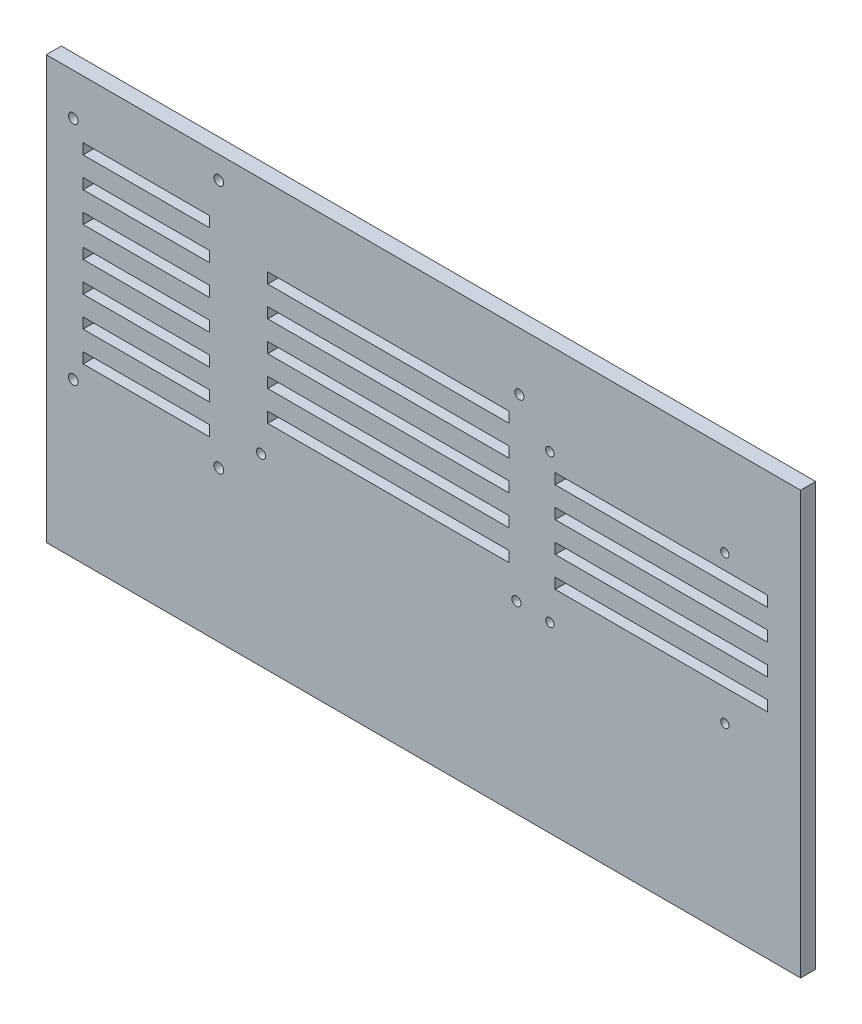
from build123d import *

# Parameters (mm, degrees)
CROQUIS1_W              = 250
CROQUIS1_H              = 140
CROQUIS1_R              = 1.6
CROQUIS1_R_2            = 1.375
CROQUIS1_R_3            = 1.5
CROQUIS1_W_2            = 41.859919993
CROQUIS1_H_2            = 3.5
CROQUIS1_W_3            = 79.963180499
CROQUIS1_W_4            = 70.346682928
SALIENTE_EXTRUIR1_DEPTH = 5


with BuildPart() as part:
    # Croquis1 → Saliente-Extruir1 (new body)
    with BuildSketch(Plane.XY):
        with Locations((14.354712009, 16.335108086)):
            Rectangle(CROQUIS1_W, CROQUIS1_H)
        with Locations((-101.706636686, -2.394891914)):
            Circle(CROQUIS1_R, mode=Mode.SUBTRACT)
        with Locations((-53.446636686, -3.664891914)):
            Circle(CROQUIS1_R, mode=Mode.SUBTRACT)
        with Locations((114.247224856, 6.848582104)):
            Circle(CROQUIS1_R_2, mode=Mode.SUBTRACT)
        with Locations((114.247224856, 55.848582104)):
            Circle(CROQUIS1_R_2, mode=Mode.SUBTRACT)
        with Locations((56.247224856, 6.848582104)):
            Circle(CROQUIS1_R_2, mode=Mode.SUBTRACT)
        with Locations((56.247224856, 55.848582104)):
            Circle(CROQUIS1_R_2, mode=Mode.SUBTRACT)
        with Locations((46.159209602, 67.214416737)):
            Circle(CROQUIS1_R_3, mode=Mode.SUBTRACT)
        with Locations((45.159209602, 7.414416737)):
            Circle(CROQUIS1_R_3, mode=Mode.SUBTRACT)
        with Locations((-39.460790398, 7.414416737)):
            Circle(CROQUIS1_R_3, mode=Mode.SUBTRACT)
        with Locations((-101.706636686, 72.535108086)):
            Circle(CROQUIS1_R, mode=Mode.SUBTRACT)
        with Locations((-53.446636686, 78.885108086)):
            Circle(CROQUIS1_R, mode=Mode.SUBTRACT)
        with Locations((-77.501473664, 55.441697687)):
            Rectangle(CROQUIS1_W_2, CROQUIS1_H_2, mode=Mode.SUBTRACT)
        with Locations((-77.501473664, 65.441697687)):
            Rectangle(CROQUIS1_W_2, CROQUIS1_H_2, mode=Mode.SUBTRACT)
        with Locations((-77.501473664, 45.441697687)):
            Rectangle(CROQUIS1_W_2, CROQUIS1_H_2, mode=Mode.SUBTRACT)
        with Locations((-77.501473664, 35.441697687)):
            Rectangle(CROQUIS1_W_2, CROQUIS1_H_2, mode=Mode.SUBTRACT)
        with Locations((-77.501473664, 25.441697687)):
            Rectangle(CROQUIS1_W_2, CROQUIS1_H_2, mode=Mode.SUBTRACT)
        with Locations((-77.501473664, 15.441697687)):
            Rectangle(CROQUIS1_W_2, CROQUIS1_H_2, mode=Mode.SUBTRACT)
        with Locations((-77.501473664, 5.441697687)):
            Rectangle(CROQUIS1_W_2, CROQUIS1_H_2, mode=Mode.SUBTRACT)
        with Locations((2.730039656, 48.964416737)):
            Rectangle(CROQUIS1_W_3, CROQUIS1_H_2, mode=Mode.SUBTRACT)
        with Locations((2.730039656, 58.964416737)):
            Rectangle(CROQUIS1_W_3, CROQUIS1_H_2, mode=Mode.SUBTRACT)
        with Locations((2.730039656, 38.964416737)):
            Rectangle(CROQUIS1_W_3, CROQUIS1_H_2, mode=Mode.SUBTRACT)
        with Locations((2.730039656, 28.964416737)):
            Rectangle(CROQUIS1_W_3, CROQUIS1_H_2, mode=Mode.SUBTRACT)
        with Locations((2.730039656, 18.964416737)):
            Rectangle(CROQUIS1_W_3, CROQUIS1_H_2, mode=Mode.SUBTRACT)
        with Locations((93.196116464, 38.964416737)):
            Rectangle(CROQUIS1_W_4, CROQUIS1_H_2, mode=Mode.SUBTRACT)
        with Locations((93.196116464, 48.964416737)):
            Rectangle(CROQUIS1_W_4, CROQUIS1_H_2, mode=Mode.SUBTRACT)
        with Locations((93.196116464, 28.964416737)):
            Rectangle(CROQUIS1_W_4, CROQUIS1_H_2, mode=Mode.SUBTRACT)
        with Locations((93.196116464, 18.964416737)):
            Rectangle(CROQUIS1_W_4, CROQUIS1_H_2, mode=Mode.SUBTRACT)
    extrude(amount=SALIENTE_EXTRUIR1_DEPTH)


solid = part.part
